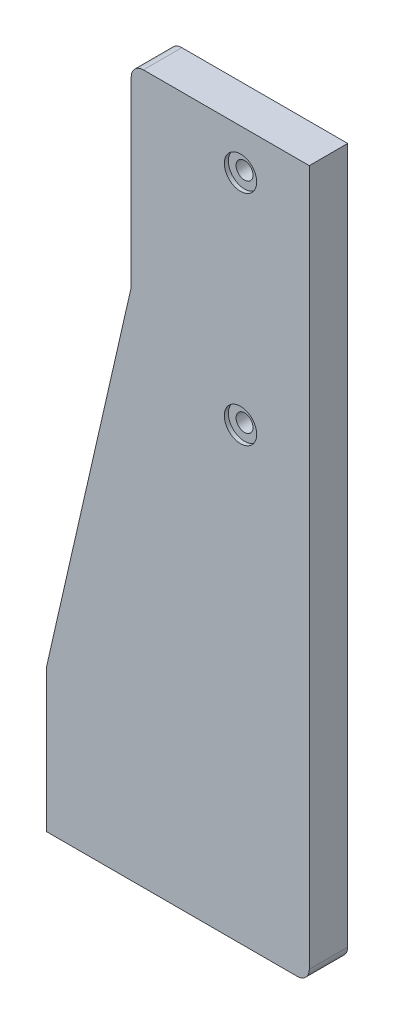
from build123d import *

# Parameters (mm, degrees)
EXTRUDE_4_DEPTH     = 9.5
SKETCH_11_R         = 2.1
CUT_EXTRUDE_8_DEPTH = 187.923112536
SKETCH_12_R         = 4
CUT_EXTRUDE_9_DEPTH = 1
FILLET_7_R          = 3


with BuildPart() as part:
    # 草图10 → 凸台-拉伸4 (new body)
    with BuildSketch(Plane.XY):
        Polygon((0, 0), (65, 0), (65, 175), (21, 175), (21, 127), (0, 35), align=None)
    extrude(amount=EXTRUDE_4_DEPTH)

    # 草图11 → 切除-拉伸8 (cut, through all)
    with BuildSketch(Plane.XY.offset(9.5)):
        with Locations((48, 165)):
            Circle(SKETCH_11_R)
        with Locations((48, 111)):
            Circle(SKETCH_11_R)
    extrude(amount=-CUT_EXTRUDE_8_DEPTH, mode=Mode.SUBTRACT)

    # 草图12 → 切除-拉伸9 (cut)
    with BuildSketch(Plane.XY.offset(9.5)):
        with Locations((48, 165)):
            Circle(SKETCH_12_R)
        with Locations((48, 111)):
            Circle(SKETCH_12_R)
    extrude(amount=-CUT_EXTRUDE_9_DEPTH, mode=Mode.SUBTRACT)

    # 圆角7
    fillet_7_edges = [part.edges().sort_by_distance(p)[0] for p in [
        (21, 175, 4.75),
        (65, 0, 4.75),
        (21, 127, 4.75),
    ]]
    fillet(fillet_7_edges, radius=FILLET_7_R)


solid = part.part
